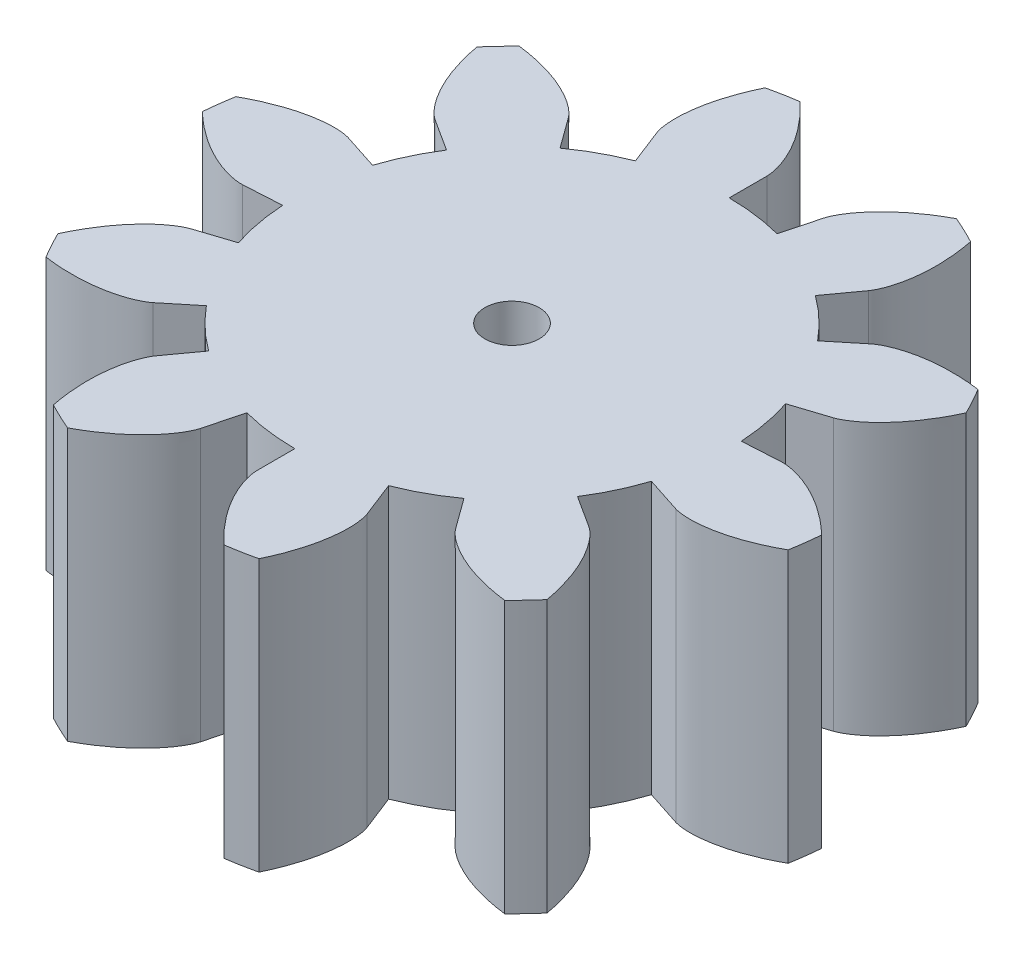
from build123d import *

# Parameters (mm, degrees)
GEAR_BILLET_R             = 12.5
GEAR_BILLET_EXTRUDE_DEPTH = 10
CUT_TOOTH_PROFILE_REACH   = 22.31
DUPLICATE_TEETH_COUNT     = 10
SKETCH1_R                 = 1
CUT_EXTRUDE1_DEPTH        = 10


with BuildPart() as part:
    # Gear billet → Gear billet Extrude (new body)
    with BuildSketch(Plane(origin=(0, 0, 0), x_dir=(1, 0, 0), z_dir=(0, 1, 0))):
        with Locations(Location((0, 0, 0), (0, 0, 270))):
            Circle(GEAR_BILLET_R)
    extrude(amount=GEAR_BILLET_EXTRUDE_DEPTH)

    # Tooth profile → Cut tooth profile (cut, up to next)
    with BuildSketch(Plane(origin=(0, 10, 0), x_dir=(1, 0, 0), z_dir=(0, 1, 0)), mode=Mode.PRIVATE) as cut_tooth_profile_sk1:
        with BuildLine():
            Line((0, 9.396926208), (0, 8))
            ThreePointArc((0, 8), (1.022652885, 7.934367087), (2.028525848, 7.738545269))
            Line((2.028525848, 7.738545269), (2.382738463, 9.089817356))
            add(Edge.make_bspline(
                [(2.382738463, 9.089817356), (2.390089539, 9.11786069), (2.414388028, 9.195379424), (2.475310721, 9.338153231), (2.594122981, 9.560512578), (2.776028643, 9.832089669), (3.040271384, 10.158546719), (3.385279893, 10.50969648), (3.797871529, 10.859185704), (4.230440505, 11.164407914), (4.558294372, 11.363295204), (4.766279848, 11.478383901), (4.84755517, 11.521771082)],
                knots=[0, 0, 0, 0, 0, 0.005604071, 0.015718253, 0.029959921, 0.048733673, 0.068727069, 0.096888899, 0.125050573, 0.153212241, 0.171038514, 0.171038514, 0.171038514, 0.171038514, 0.171038514], degree=4))
            ThreePointArc((4.84755517, 11.521771082), (1.597895133, 12.397448574), (-1.767601834, 12.374392258))
            add(Edge.make_bspline(
                [(0, 9.396926208), (0, 9.425917015), (-0.003848276, 9.507063557), (-0.026577358, 9.660619161), (-0.085123904, 9.905838113), (-0.192221911, 10.214664606), (-0.365050392, 10.597455343), (-0.609743841, 11.024611218), (-0.920232733, 11.46729759), (-1.261270665, 11.872229245), (-1.527978663, 12.147749037), (-1.699984241, 12.311814414), (-1.767601834, 12.374392258)],
                knots=[0, 0, 0, 0, 0, 0.005604071, 0.015718253, 0.029959921, 0.048733673, 0.068727069, 0.096888899, 0.125050573, 0.153212241, 0.171038514, 0.171038514, 0.171038514, 0.171038514, 0.171038514], degree=4))
        make_face()
    cut_tooth_profile_tool1 = extrude(cut_tooth_profile_sk1.sketch, amount=-CUT_TOOTH_PROFILE_REACH, mode=Mode.PRIVATE) & part.part
    cut_tooth_profile = cut_tooth_profile_tool1.solids().sort_by_distance((1.363478, 10, -10.578699))[0]
    add(cut_tooth_profile, mode=Mode.SUBTRACT)

    # Duplicate teeth: Cut tooth profile ×10 about axis
    duplicate_teeth_axis = Axis((0, 10, 0), (0, -1, 0))
    for i in range(1, DUPLICATE_TEETH_COUNT):
        add(cut_tooth_profile.rotate(duplicate_teeth_axis, i * 360 / DUPLICATE_TEETH_COUNT), mode=Mode.SUBTRACT)

    # Sketch1 → Cut-Extrude1 (cut)
    with BuildSketch(Plane.XZ):
        with Locations(Location((0, 0, 0), (0, 0, 270))):
            Circle(SKETCH1_R)
    extrude(amount=-CUT_EXTRUDE1_DEPTH, mode=Mode.SUBTRACT)


solid = part.part
